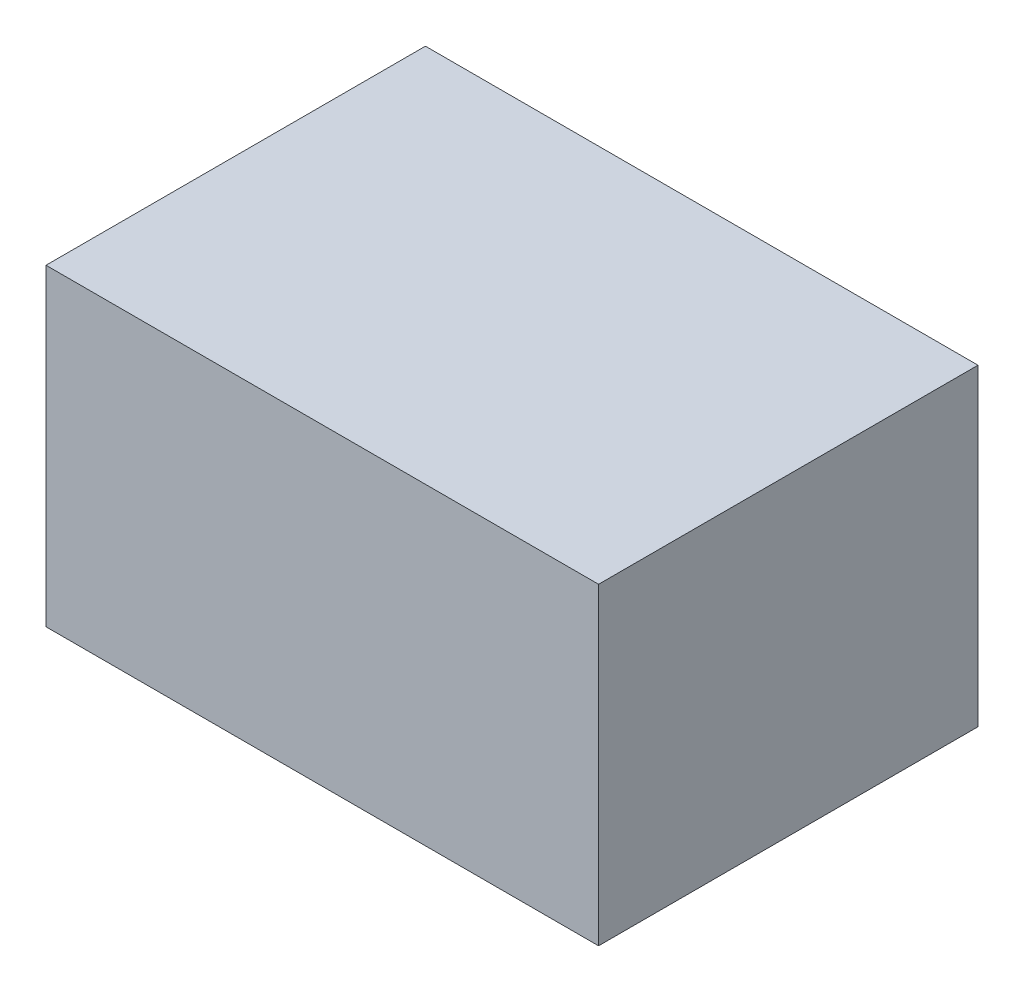
from build123d import *

# Parameters (mm, degrees)
SKETCH1_W           = 30
SKETCH1_H           = 20.6
BOSS_EXTRUDE1_DEPTH = 17


with BuildPart() as part:
    # Sketch1 → Boss-Extrude1 (new body)
    with BuildSketch(Plane(origin=(0, 0, 0), x_dir=(1, 0, 0), z_dir=(0, 1, 0))):
        Rectangle(SKETCH1_W, SKETCH1_H)
    extrude(amount=BOSS_EXTRUDE1_DEPTH)


solid = part.part
